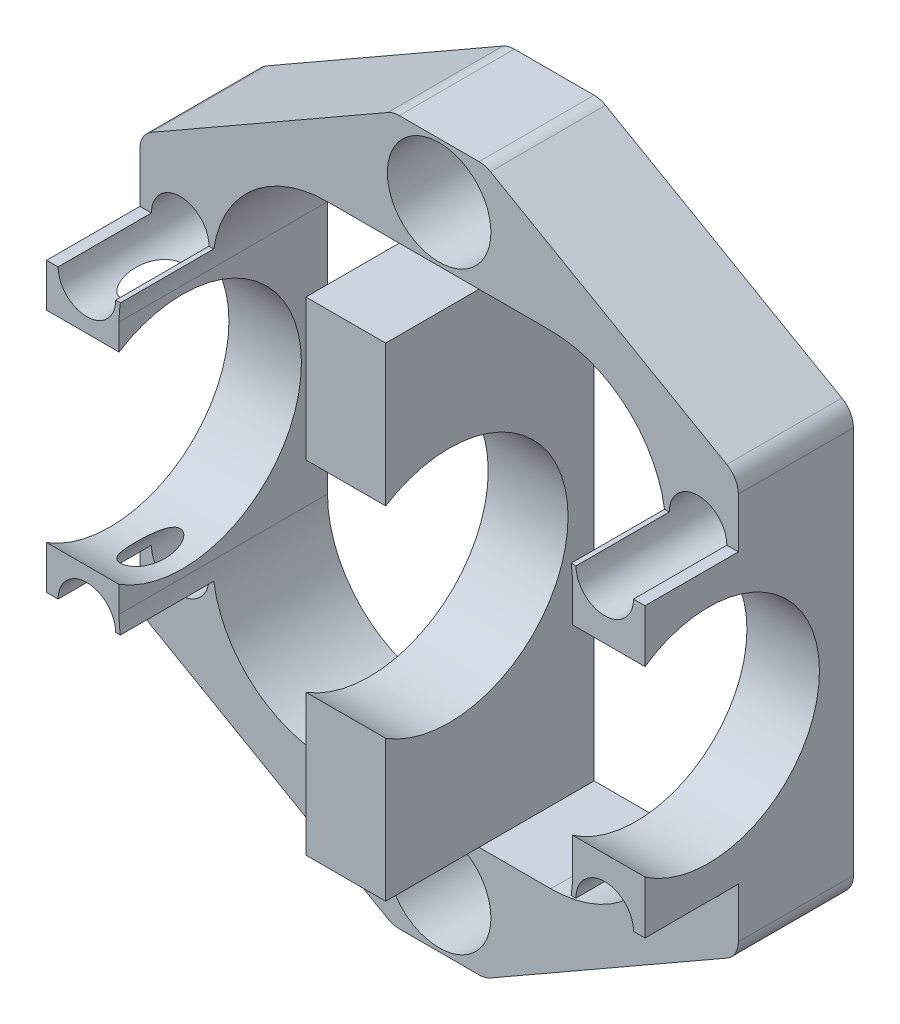
from build123d import *

# Parameters (mm, degrees)
BOSS_EXTRUDE1_DEPTH = 12.7
SKETCH1_4_W         = 8.808271716
SKETCH1_4_H         = 53.34
BOSS_EXTRUDE3_DEPTH = 23
CUT_EXTRUDE3_REACH  = 82.003
SKETCH9_R           = 13.125
CUT_EXTRUDE4_REACH  = 82.003
SKETCH8_R           = 12.25


with BuildPart() as part:
    # Sketch1 → Boss-Extrude1 (new body)
    with BuildSketch(Plane.XY):
        with BuildLine():
            Line((4.404135858, -36.408089009), (4.404135858, -38.862))
            ThreePointArc((4.404135858, -38.862), (5.057273366, -38.776589863), (5.666486021, -38.52610346))
            Line((5.666486021, -38.52610346), (11.954126984, -34.925))
            Line((11.954126984, -34.925), (5.291497331, -34.925))
            ThreePointArc((5.291497331, -34.925), (4.904203705, -35.700282028), (4.404135858, -36.408089009))
        make_face()
        with BuildLine():
            Line((-4.404135858, -36.408089009), (-4.404135858, -38.862))
            Line((-4.404135858, -38.862), (4.404135858, -38.862))
            Line((4.404135858, -38.862), (4.404135858, -36.408089009))
            ThreePointArc((4.404135858, -36.408089009), (0, -38.481), (-4.404135858, -36.408089009))
        make_face()
        with BuildLine():
            Line((4.404135858, -26.67), (4.404135858, -29.123910991))
            ThreePointArc((4.404135858, -29.123910991), (5.377307013, -30.830594542), (5.715, -32.766))
            ThreePointArc((5.715, -32.766), (5.60812501, -33.866072215), (5.291497331, -34.925))
            Line((5.291497331, -34.925), (11.954126984, -34.925))
            Line((11.954126984, -34.925), (31.742350164, -23.591744906))
            ThreePointArc((31.742350164, -23.591744906), (32.677495098, -22.661460621), (33.02, -21.387641446))
            Line((33.02, -21.387641446), (33.02, -15.875))
            Line((33.02, -15.875), (31.75, -15.875))
            ThreePointArc((31.75, -15.875), (28.575, -19.05), (25.4, -15.875))
            Line((25.4, -15.875), (24.875312158, -15.875))
            ThreePointArc((24.875312158, -15.875), (20.598387055, -23.600251814), (12.319, -26.67))
            Line((12.319, -26.67), (4.404135858, -26.67))
        make_face()
        with BuildLine():
            Line((-33.02, -15.875), (-33.02, -21.387641446))
            ThreePointArc((-33.02, -21.387641446), (-32.677495098, -22.661460621), (-31.742350164, -23.591744906))
            Line((-31.742350164, -23.591744906), (-11.954126984, -34.925))
            Line((-11.954126984, -34.925), (-5.291497331, -34.925))
            ThreePointArc((-5.291497331, -34.925), (-5.649290588, -31.901858317), (-4.404135858, -29.123910991))
            Line((-4.404135858, -29.123910991), (-4.404135858, -26.67))
            Line((-4.404135858, -26.67), (-12.319, -26.67))
            ThreePointArc((-12.319, -26.67), (-20.598387055, -23.600251814), (-24.875312158, -15.875))
            Line((-24.875312158, -15.875), (-25.4, -15.875))
            ThreePointArc((-25.4, -15.875), (-28.575, -19.05), (-31.75, -15.875))
            Line((-31.75, -15.875), (-33.02, -15.875))
        make_face()
        with BuildLine():
            Line((-5.291497331, -34.925), (-11.954126984, -34.925))
            Line((-11.954126984, -34.925), (-5.666486021, -38.52610346))
            ThreePointArc((-5.666486021, -38.52610346), (-5.057273366, -38.776589863), (-4.404135858, -38.862))
            Line((-4.404135858, -38.862), (-4.404135858, -36.408089009))
            ThreePointArc((-4.404135858, -36.408089009), (-4.904203705, -35.700282028), (-5.291497331, -34.925))
        make_face()
        with BuildLine():
            Line((-4.404135858, -26.67), (-4.404135858, -29.123910991))
            ThreePointArc((-4.404135858, -29.123910991), (0, -27.051), (4.404135858, -29.123910991))
            Line((4.404135858, -29.123910991), (4.404135858, -26.67))
            Line((4.404135858, -26.67), (-4.404135858, -26.67))
        make_face()
        with BuildLine():
            Line((4.404135858, 29.123910991), (4.404135858, 26.67))
            Line((4.404135858, 26.67), (12.319, 26.67))
            ThreePointArc((12.319, 26.67), (20.598387055, 23.600251814), (24.875312158, 15.875))
            Line((24.875312158, 15.875), (25.4, 15.875))
            ThreePointArc((25.4, 15.875), (28.575, 19.05), (31.75, 15.875))
            Line((31.75, 15.875), (33.02, 15.875))
            Line((33.02, 15.875), (33.02, 21.387641446))
            ThreePointArc((33.02, 21.387641446), (32.677495098, 22.661460621), (31.742350164, 23.591744906))
            Line((31.742350164, 23.591744906), (11.954126984, 34.925))
            Line((11.954126984, 34.925), (5.291497331, 34.925))
            ThreePointArc((5.291497331, 34.925), (5.60812501, 33.866072215), (5.715, 32.766))
            ThreePointArc((5.715, 32.766), (5.377307013, 30.830594542), (4.404135858, 29.123910991))
        make_face()
        with BuildLine():
            ThreePointArc((5.666486021, 38.52610346), (5.057273366, 38.776589863), (4.404135858, 38.862))
            Line((4.404135858, 38.862), (4.404135858, 36.408089009))
            ThreePointArc((4.404135858, 36.408089009), (4.904203705, 35.700282028), (5.291497331, 34.925))
            Line((5.291497331, 34.925), (11.954126984, 34.925))
            Line((11.954126984, 34.925), (5.666486021, 38.52610346))
        make_face()
        with BuildLine():
            Line((4.404135858, 38.862), (-4.404135858, 38.862))
            Line((-4.404135858, 38.862), (-4.404135858, 36.408089009))
            ThreePointArc((-4.404135858, 36.408089009), (0, 38.481), (4.404135858, 36.408089009))
            Line((4.404135858, 36.408089009), (4.404135858, 38.862))
        make_face()
        with BuildLine():
            Line((-33.02, 21.387641446), (-33.02, 15.875))
            Line((-33.02, 15.875), (-31.75, 15.875))
            ThreePointArc((-31.75, 15.875), (-28.575, 19.05), (-25.4, 15.875))
            Line((-25.4, 15.875), (-24.875312158, 15.875))
            ThreePointArc((-24.875312158, 15.875), (-20.598387055, 23.600251814), (-12.319, 26.67))
            Line((-12.319, 26.67), (-4.404135858, 26.67))
            Line((-4.404135858, 26.67), (-4.404135858, 29.123910991))
            ThreePointArc((-4.404135858, 29.123910991), (-5.649290588, 31.901858317), (-5.291497331, 34.925))
            Line((-5.291497331, 34.925), (-11.954126984, 34.925))
            Line((-11.954126984, 34.925), (-31.742350164, 23.591744906))
            ThreePointArc((-31.742350164, 23.591744906), (-32.677495098, 22.661460621), (-33.02, 21.387641446))
        make_face()
        with BuildLine():
            Line((-5.666486021, 38.52610346), (-11.954126984, 34.925))
            Line((-11.954126984, 34.925), (-5.291497331, 34.925))
            ThreePointArc((-5.291497331, 34.925), (-4.904203705, 35.700282028), (-4.404135858, 36.408089009))
            Line((-4.404135858, 36.408089009), (-4.404135858, 38.862))
            ThreePointArc((-4.404135858, 38.862), (-5.057273366, 38.776589863), (-5.666486021, 38.52610346))
        make_face()
        with BuildLine():
            Line((-4.404135858, 29.123910991), (-4.404135858, 26.67))
            Line((-4.404135858, 26.67), (4.404135858, 26.67))
            Line((4.404135858, 26.67), (4.404135858, 29.123910991))
            ThreePointArc((4.404135858, 29.123910991), (0, 27.051), (-4.404135858, 29.123910991))
        make_face()
    extrude(amount=BOSS_EXTRUDE1_DEPTH)

    # Sketch1<4> → Boss-Extrude3 (add)
    with BuildSketch(Plane.XY):
        with BuildLine():
            ThreePointArc((25.019, -13.97), (24.983027093, -14.925205632), (24.875312158, -15.875))
            Line((24.875312158, -15.875), (25.4, -15.875))
            ThreePointArc((25.4, -15.875), (28.575, -12.7), (31.75, -15.875))
            Line((31.75, -15.875), (33.02, -15.875))
            Line((33.02, -15.875), (33.02, 15.875))
            Line((33.02, 15.875), (31.75, 15.875))
            ThreePointArc((31.75, 15.875), (28.575, 12.7), (25.4, 15.875))
            Line((25.4, 15.875), (24.875312158, 15.875))
            ThreePointArc((24.875312158, 15.875), (24.983027093, 14.925205632), (25.019, 13.97))
            Line((25.019, 13.97), (25.019, -13.97))
        make_face()
        with BuildLine():
            Line((-33.02, 15.875), (-33.02, -15.875))
            Line((-33.02, -15.875), (-31.75, -15.875))
            ThreePointArc((-31.75, -15.875), (-28.575, -12.7), (-25.4, -15.875))
            Line((-25.4, -15.875), (-24.875312158, -15.875))
            ThreePointArc((-24.875312158, -15.875), (-24.983027093, -14.925205632), (-25.019, -13.97))
            Line((-25.019, -13.97), (-25.019, 13.97))
            ThreePointArc((-25.019, 13.97), (-24.983027093, 14.925205632), (-24.875312158, 15.875))
            Line((-24.875312158, 15.875), (-25.4, 15.875))
            ThreePointArc((-25.4, 15.875), (-28.575, 12.7), (-31.75, 15.875))
            Line((-31.75, 15.875), (-33.02, 15.875))
        make_face()
        Rectangle(SKETCH1_4_W, SKETCH1_4_H)
    extrude(amount=BOSS_EXTRUDE3_DEPTH)

    # Cut-Extrude3: up to this face of the body (flat: up to its plane)
    cut_extrude3_end = Plane(part.part.faces().sort_by_distance((4.404135858, 0, 11.5))[0])
    # Sketch9 → Cut-Extrude3 (cut, up to the picked face)
    with BuildSketch(Plane.ZY.offset(33.02), mode=Mode.PRIVATE) as cut_extrude3_sk1:
        with Locations((16, 0)):
            Circle(SKETCH9_R)
    cut_extrude3_tool1 = split(extrude(cut_extrude3_sk1.sketch, amount=-CUT_EXTRUDE3_REACH, mode=Mode.PRIVATE), bisect_by=cut_extrude3_end, keep=Keep.BOTH, mode=Mode.PRIVATE)
    add(cut_extrude3_tool1.solids().sort_by(Axis((-33.02, 0, 16), (1, 0, 0)))[0], mode=Mode.SUBTRACT)

    # Sketch8 → Cut-Extrude4 (cut, up to next)
    with BuildSketch(Plane(origin=(33.02, 0, 0), x_dir=(0, 0, -1), z_dir=(1, 0, 0)), mode=Mode.PRIVATE) as cut_extrude4_sk1:
        with Locations((-16, 0)):
            Circle(SKETCH8_R)
    cut_extrude4_tool1 = extrude(cut_extrude4_sk1.sketch, amount=-CUT_EXTRUDE4_REACH, mode=Mode.PRIVATE) & part.part
    add(cut_extrude4_tool1.solids().sort_by_distance((33.02, 0, 16))[0], mode=Mode.SUBTRACT)


solid = part.part
